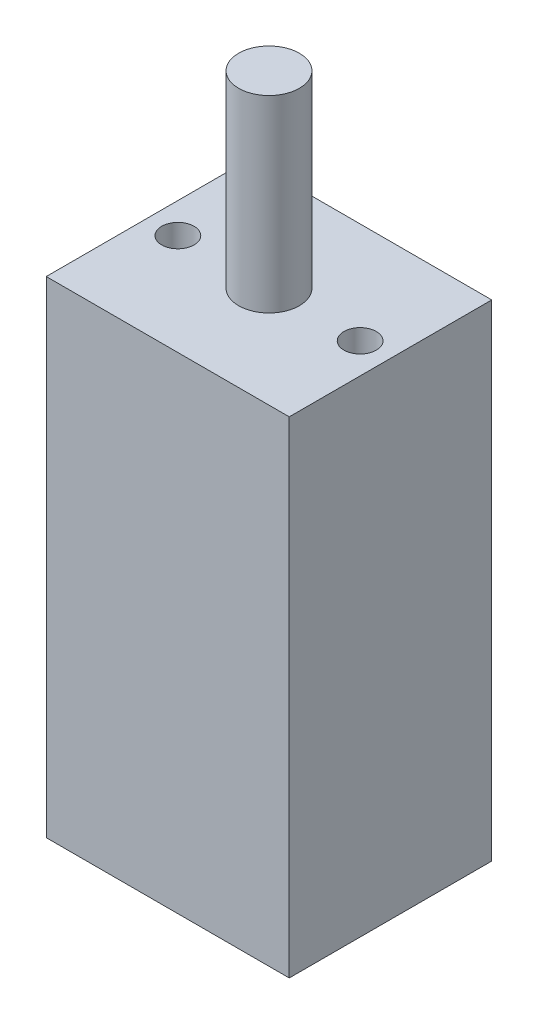
from build123d import *

# Parameters (mm, degrees)
SKETCH_1_W      = 12
SKETCH_1_H      = 10
SKETCH_1_R      = 0.8
EXTRUDE_1_DEPTH = 24
SKETCH_2_R      = 1.5
EXTRUDE_2_DEPTH = 9.3


with BuildPart() as part:
    # 스케치1 → 보스-돌출1 (new body)
    with BuildSketch(Plane(origin=(0, 0, 0), x_dir=(1, 0, 0), z_dir=(0, 1, 0))):
        Rectangle(SKETCH_1_W, SKETCH_1_H)
        with Locations(Location((4.5, 0, 0), (0, 0, 270))):
            Circle(SKETCH_1_R, mode=Mode.SUBTRACT)
        with Locations(Location((-4.5, 0, 0), (0, 0, 270))):
            Circle(SKETCH_1_R, mode=Mode.SUBTRACT)
    extrude(amount=EXTRUDE_1_DEPTH)

    # 스케치2 → 보스-돌출2 (add)
    with BuildSketch(Plane(origin=(0, 24, 0), x_dir=(1, 0, 0), z_dir=(0, 1, 0))):
        with Locations(Location((0, 0, 0), (0, 0, 90))):
            Circle(SKETCH_2_R)
    extrude(amount=EXTRUDE_2_DEPTH)


solid = part.part
